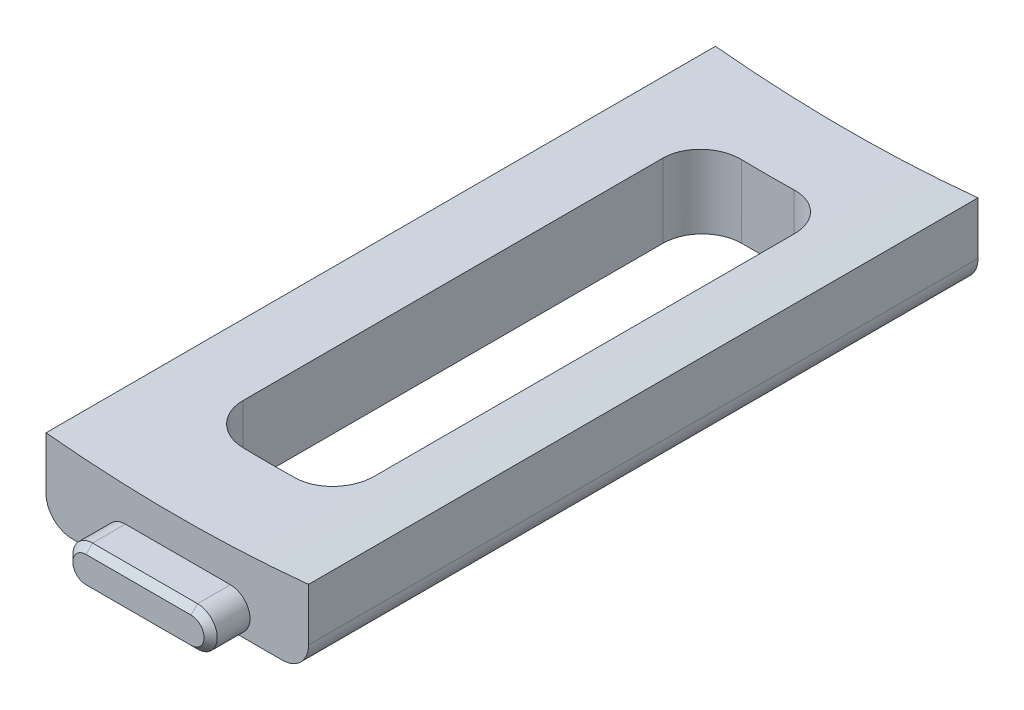
from build123d import *

# Parameters (mm, degrees)
EXTRUDE_1_DEPTH     = 3
EXTRUDE_2_DEPTH     = 51
EXTRUDE_3_DEPTH     = 3
FILLET_1_R          = 2
CHAMFER_1_SIZE      = 0.5
SKETCH_4_W          = 10
SKETCH_4_H          = 38
CUT_EXTRUDE_1_DEPTH = 59.180882402
FILLET_2_R          = 3


with BuildPart() as part:
    # 草图1 → 凸台-拉伸1 (new body)
    with BuildSketch(Plane.XY):
        with BuildLine():
            Line((-4, 1.5), (4, 1.5))
            ThreePointArc((4, 1.5), (5.5, 0), (4, -1.5))
            Line((4, -1.5), (-4, -1.5))
            ThreePointArc((-4, -1.5), (-5.5, 0), (-4, 1.5))
        make_face()
    extrude(amount=EXTRUDE_1_DEPTH)

    # 草图2 → 凸台-拉伸2 (add)
    with BuildSketch(Plane.XY.offset(3)):
        with BuildLine():
            Line((-10, 4.501256289), (-10, -1.5))
            Line((-10, -1.5), (-4, -1.5))
            ThreePointArc((-4, -1.5), (-5.5, 0), (-4, 1.5))
            Line((-4, 1.5), (4, 1.5))
            ThreePointArc((4, 1.5), (5.5, 0), (4, -1.5))
            Line((4, -1.5), (10, -1.5))
            Line((10, -1.5), (10, 4.501256289))
            ThreePointArc((10, 4.501256289), (0, 4), (-10, 4.501256289))
        make_face()
        with BuildLine():
            Line((4, 1.5), (-4, 1.5))
            ThreePointArc((-4, 1.5), (-5.5, 0), (-4, -1.5))
            Line((-4, -1.5), (4, -1.5))
            ThreePointArc((4, -1.5), (5.5, 0), (4, 1.5))
        make_face()
    extrude(amount=EXTRUDE_2_DEPTH)

    # 草图3 → 凸台-拉伸3 (add)
    with BuildSketch(Plane.XY.offset(54)):
        with BuildLine():
            Line((-3.954732622, 1.5), (4.045267378, 1.5))
            ThreePointArc((4.045267378, 1.5), (5.545267378, 0), (4.045267378, -1.5))
            Line((4.045267378, -1.5), (-3.954732622, -1.5))
            ThreePointArc((-3.954732622, -1.5), (-5.454732622, 0), (-3.954732622, 1.5))
        make_face()
    extrude(amount=EXTRUDE_3_DEPTH)

    # 圆角1
    fillet_1_edges = [part.edges().sort_by_distance(p)[0] for p in [
        (-10, -1.5, 28.5),
        (10, -1.5, 28.5),
    ]]
    fillet(fillet_1_edges, radius=FILLET_1_R)

    # 倒角1
    chamfer_1_edges = [part.edges().sort_by_distance(p)[0] for p in [
        (-5.454732622, 0, 57),
        (0.045267378, -1.5, 57),
        (5.545267378, 0, 57),
        (0.045267378, 1.5, 57),
        (0, 1.5, 0),
        (5.5, 0, 0),
        (0, -1.5, 0),
        (-5.5, 0, 0),
    ]]
    chamfer(chamfer_1_edges, length=CHAMFER_1_SIZE)

    # 草图4 → 切除-拉伸1 (cut, through all)
    with BuildSketch(Plane.XZ.offset(1.5)):
        with Locations((0, 28)):
            Rectangle(SKETCH_4_W, SKETCH_4_H)
    extrude(amount=-CUT_EXTRUDE_1_DEPTH, mode=Mode.SUBTRACT)

    # 圆角2
    fillet_2_edges = [part.edges().sort_by_distance(p)[0] for p in [
        (5, 1.312539111, 47),
        (5, 1.312539111, 9),
        (-5, 1.312539111, 9),
        (-5, 1.312539111, 47),
    ]]
    fillet(fillet_2_edges, radius=FILLET_2_R)


solid = part.part
